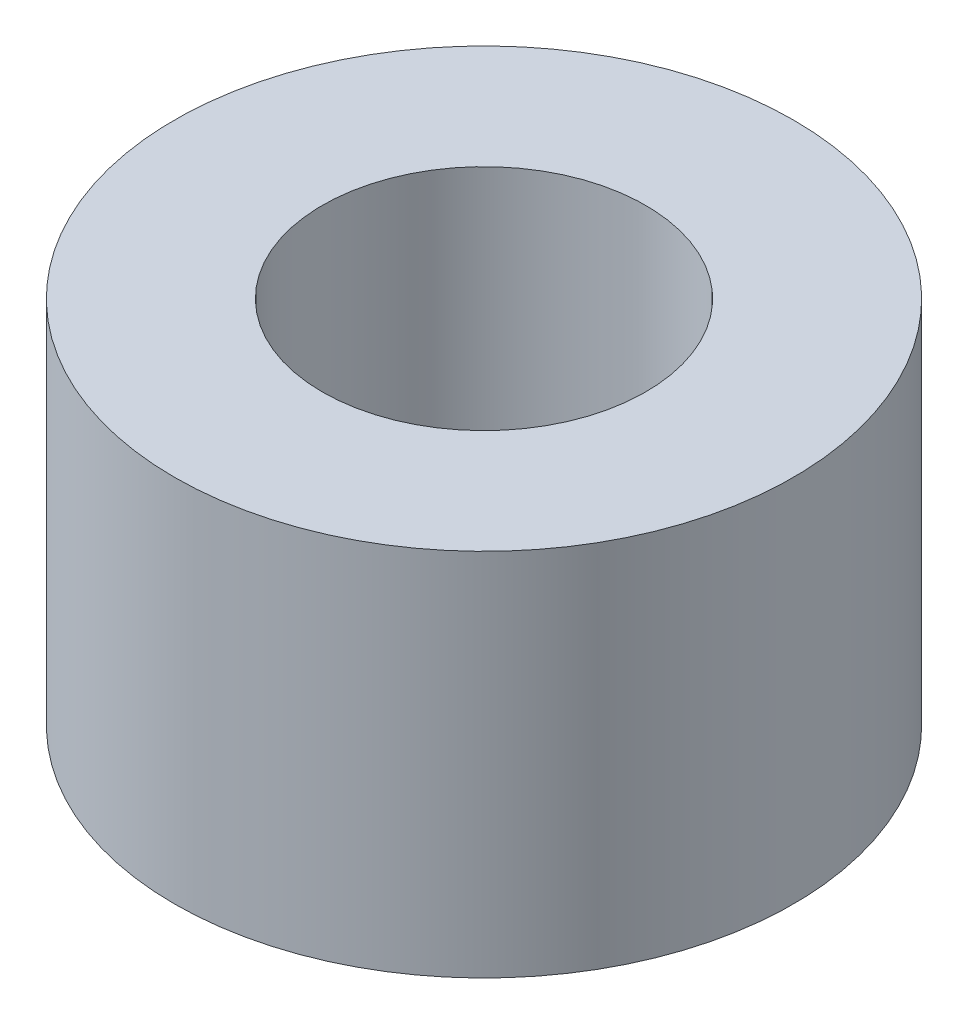
from build123d import *

# Parameters (mm, degrees)
SKETCH1_R           = 3.35
SKETCH1_R_2         = 1.75
BOSS_EXTRUDE1_DEPTH = 4


with BuildPart() as part:
    # Sketch1 → Boss-Extrude1 (new body)
    with BuildSketch(Plane(origin=(0, 0, 0), x_dir=(1, 0, 0), z_dir=(0, 1, 0))):
        with Locations(Location((0, 0, 0), (0, 0, 270))):
            Circle(SKETCH1_R)
        with Locations(Location((0, 0, 0), (0, 0, 270))):
            Circle(SKETCH1_R_2, mode=Mode.SUBTRACT)
    extrude(amount=BOSS_EXTRUDE1_DEPTH)


solid = part.part
